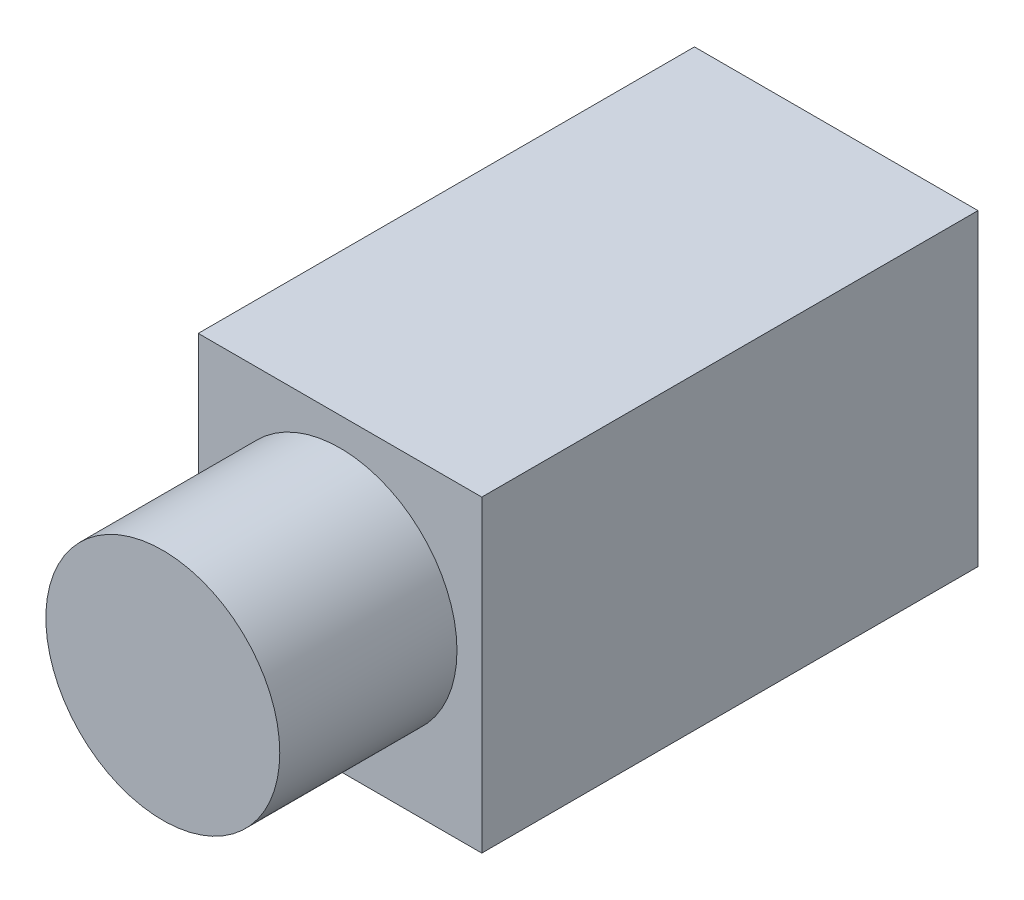
from build123d import *

# Parameters (mm, degrees)
SKETCH2_W                = 40
SKETCH2_H                = 70
BOSS_EXTRUDE1_DEPTH      = 43.5
SKETCH4_R                = 16.5
BOSS_EXTRUDE2_DEPTH      = 25
M3_CLEARANCE_HOLE1_D     = 3.2
M3_CLEARANCE_HOLE1_DEPTH = 3.18
M3_CLEARANCE_HOLE1_TIP   = 0.96137699


with BuildPart() as part:
    # Sketch2 → Boss-Extrude1 (new body)
    with BuildSketch(Plane(origin=(0, 0, 0), x_dir=(1, 0, 0), z_dir=(0, 1, 0))):
        Rectangle(SKETCH2_W, SKETCH2_H)
    extrude(amount=BOSS_EXTRUDE1_DEPTH)

    # Sketch4 → Boss-Extrude2 (add)
    with BuildSketch(Plane.XY.offset(35)):
        with Locations((0, 23)):
            Circle(SKETCH4_R)
    extrude(amount=BOSS_EXTRUDE2_DEPTH)

    # M3 Clearance Hole1
    with Locations(Plane(origin=(0, 0, 0), x_dir=(-1, 0, 0), z_dir=(0, -1, 0))):
        with Locations((-7, 20), (7, 20), (7, -25), (-7, -25)):
            Hole(M3_CLEARANCE_HOLE1_D / 2, depth=M3_CLEARANCE_HOLE1_DEPTH)
            with Locations((0, 0, -(M3_CLEARANCE_HOLE1_DEPTH + M3_CLEARANCE_HOLE1_TIP / 2))):  # 118° drill point
                Cone(0, M3_CLEARANCE_HOLE1_D / 2, M3_CLEARANCE_HOLE1_TIP, mode=Mode.SUBTRACT)


solid = part.part
